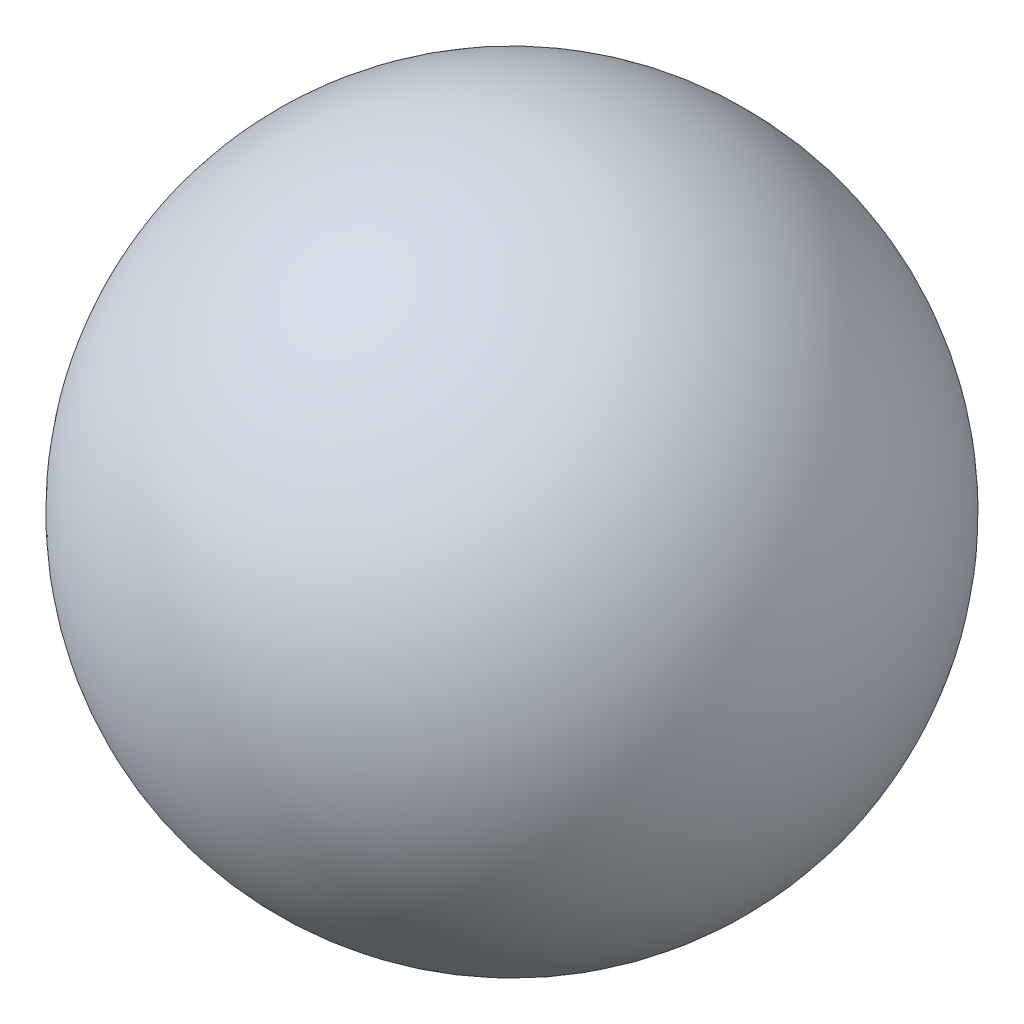
from build123d import *


with BuildPart() as part:
    # Schizzo1 → Rivoluzione1 (revolve)
    with BuildSketch(Plane.XY):
        with BuildLine():
            Line((53.606, 66.275), (29.794, 66.275))
            ThreePointArc((29.794, 66.275), (41.7, 78.181), (53.606, 66.275))
        make_face()
    revolve(axis=Axis((53.606, 66.275, 0), (-1, 0, 0)))


solid = part.part
